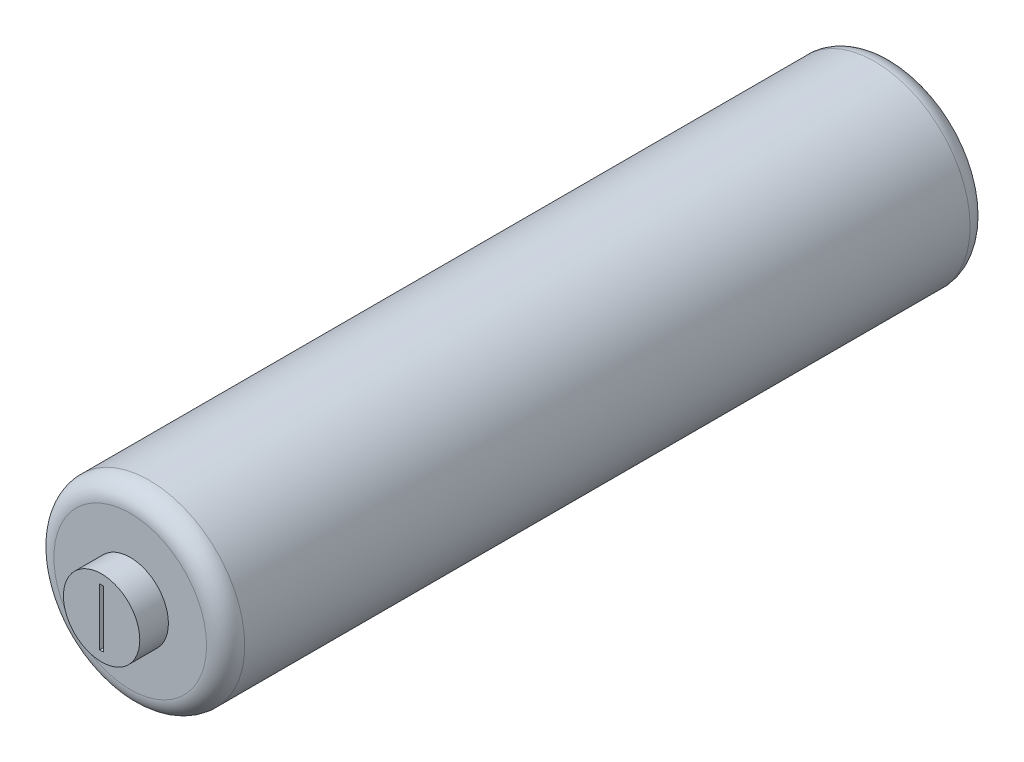
from build123d import *

# Parameters (mm, degrees)
SKETCH1_R           = 250
BOSS_EXTRUDE4_DEPTH = 1000
SKETCH6_R           = 100
BOSS_EXTRUDE5_DEPTH = 75
SKETCH8_W           = 10
SKETCH8_H           = 150
CUT_EXTRUDE7_DEPTH  = 10
FILLET1_R           = 50


with BuildPart() as part:
    # Sketch1 → Boss-Extrude4 (new, symmetric)
    with BuildSketch(Plane.XY):
        Circle(SKETCH1_R)
    extrude(amount=BOSS_EXTRUDE4_DEPTH, both=True)

    # Sketch6 → Boss-Extrude5 (add, symmetric)
    with BuildSketch(Plane.XY.offset(1000)):
        Circle(SKETCH6_R)
    boss_extrude5 = extrude(amount=BOSS_EXTRUDE5_DEPTH, both=True)

    # Sketch8 → Cut-Extrude7 (cut)
    with BuildSketch(Plane.XY.offset(1075)):
        Rectangle(SKETCH8_W, SKETCH8_H)
    cut_extrude7 = extrude(amount=-CUT_EXTRUDE7_DEPTH, mode=Mode.SUBTRACT)

    # Mirror3: Boss-Extrude5, Cut-Extrude7 across plane
    add(boss_extrude5.mirror(Plane.XY))
    add(cut_extrude7.mirror(Plane.XY), mode=Mode.SUBTRACT)

    # Fillet1
    fillet1_edges = [part.edges().sort_by_distance(p)[0] for p in [
        (-250, 0, -1000),
        (-250, 0, 1000),
    ]]
    fillet(fillet1_edges, radius=FILLET1_R)


solid = part.part
